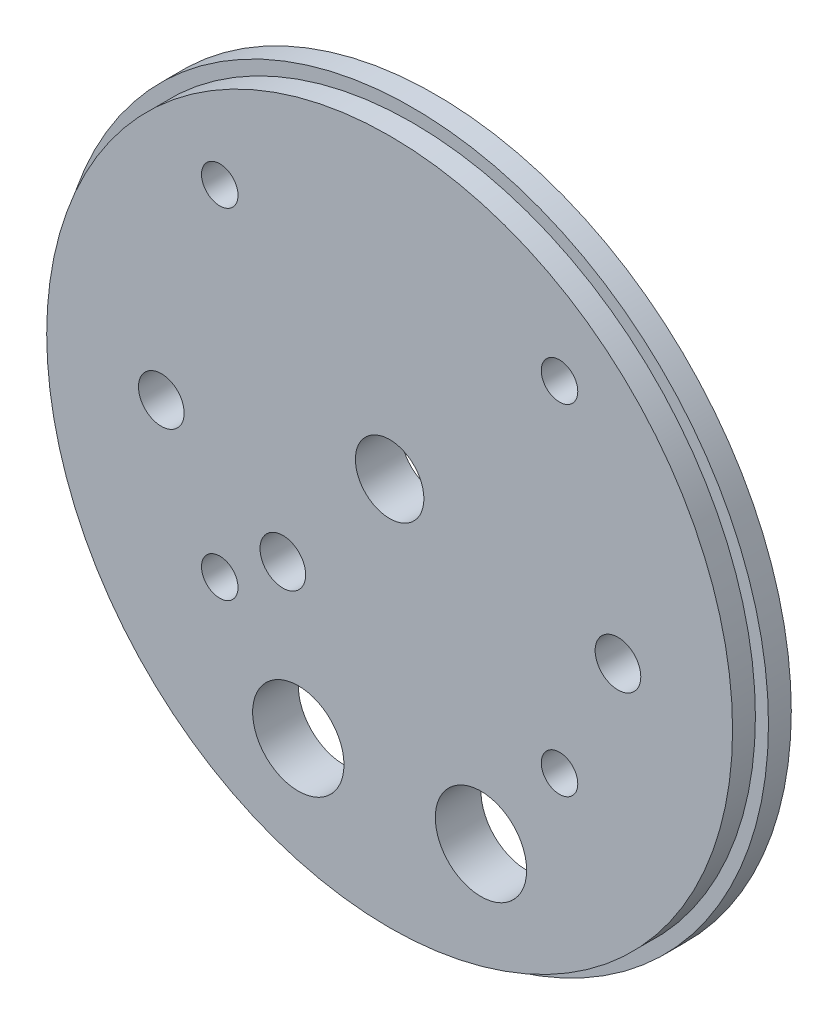
from build123d import *

# Parameters (mm, degrees)
SKETCH1_R           = 49.5046
BOSS_EXTRUDE1_DEPTH = 3.175
SKETCH2_R           = 47.6885
BOSS_EXTRUDE2_DEPTH = 3.175
SKETCH3_R           = 6.35
SKETCH3_R_2         = 3.175
SKETCH3_R_3         = 4.7625
SKETCH3_R_4         = 2.54
CUT_EXTRUDE1_DEPTH  = 71.297463271


with BuildPart() as part:
    # Sketch1 → Boss-Extrude1 (new body)
    with BuildSketch(Plane.XY):
        Circle(SKETCH1_R)
    extrude(amount=BOSS_EXTRUDE1_DEPTH)

    # Sketch2 → Boss-Extrude2 (add)
    with BuildSketch(Plane.XY.offset(3.175)):
        Circle(SKETCH2_R)
    extrude(amount=BOSS_EXTRUDE2_DEPTH)

    # Sketch3 → Cut-Extrude1 (cut, through all)
    with BuildSketch(Plane.XY.offset(6.35)):
        with Locations((-12.7, -31.235352443)):
            Circle(SKETCH3_R)
        with Locations((12.7, -31.235352443)):
            Circle(SKETCH3_R)
        with Locations((-31.75, 0)):
            Circle(SKETCH3_R_2)
        with Locations((31.75, 0)):
            Circle(SKETCH3_R_2)
        with Locations((0, 6.35)):
            Circle(SKETCH3_R_3)
        with Locations((-14.850390051, -11.029456704)):
            Circle(SKETCH3_R_2)
        with Locations((-23.622, 29.972)):
            Circle(SKETCH3_R_4)
        with Locations((23.622, 29.972)):
            Circle(SKETCH3_R_4)
        with Locations((23.622, -17.272)):
            Circle(SKETCH3_R_4)
        with Locations((-23.622, -17.272)):
            Circle(SKETCH3_R_4)
    extrude(amount=-CUT_EXTRUDE1_DEPTH, mode=Mode.SUBTRACT)


solid = part.part
